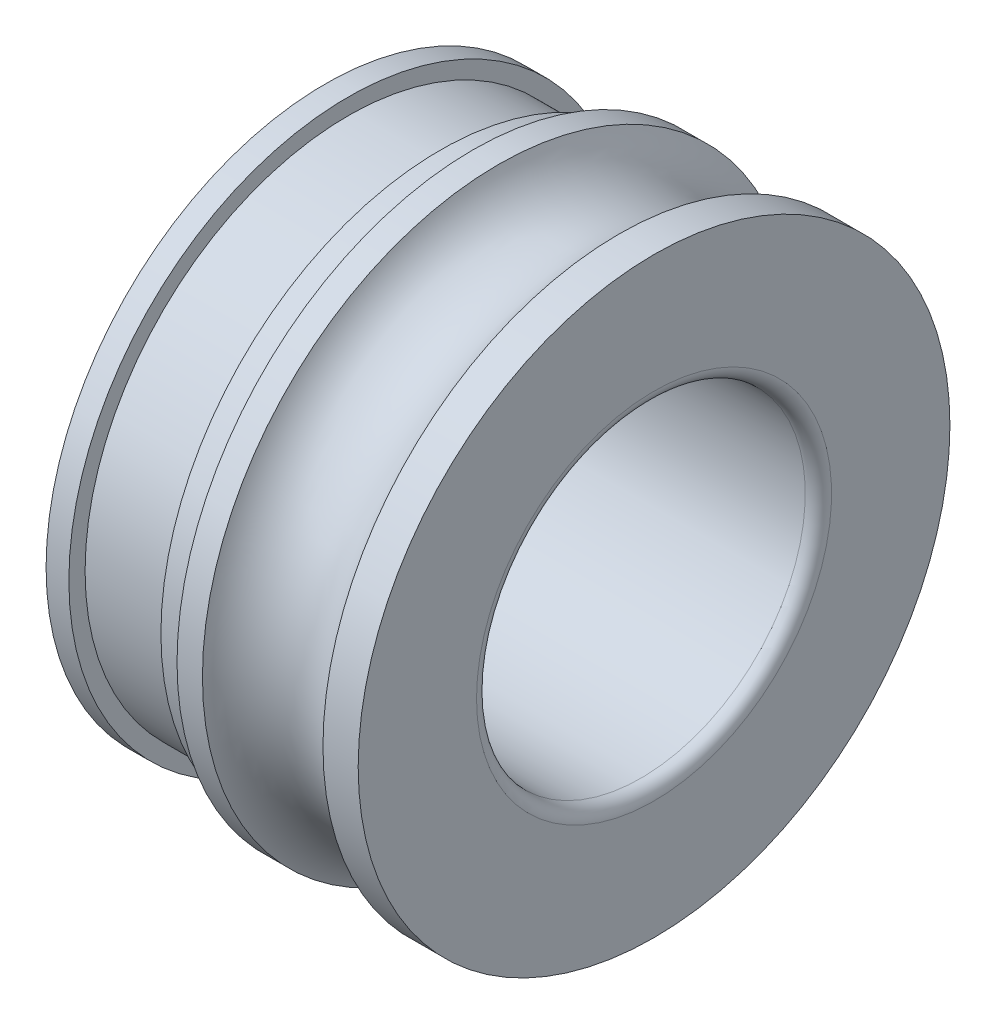
from build123d import *


with BuildPart() as part:
    # Esquisse1 → Base-Révolution (revolve)
    with BuildSketch(Plane.XY, mode=Mode.PRIVATE) as base_r_volution_sk:
        with BuildLine():
            Line((1, 12.5), (24, 12.5))
            ThreePointArc((24, 12.5), (24.707106781, 12.792893219), (25, 13.5))
            Line((25, 13.5), (25, 22.5))
            Line((25, 22.5), (22.321383042, 22.499995211))
            ThreePointArc((22.321383042, 22.499995211), (17.738807347, 19.499995211), (13.156231652, 22.499995211))
            Line((13.156231652, 22.499995211), (11.22402651, 22.499995211))
            Line((11.22402651, 22.499995211), (11.232186751, 21.25))
            Line((11.232186751, 21.25), (8.732186751, 21.233679457))
            Line((8.732186751, 21.233679457), (8.732186751, 20))
            Line((8.732186751, 20), (1.732186751, 20))
            Line((1.732186751, 20), (1.732186751, 21.233679457))
            Line((1.732186751, 21.233679457), (0, 21.233679457))
            Line((0, 21.233679457), (0, 20))
            Line((0, 20), (0, 13.5))
            ThreePointArc((0, 13.5), (0.292893219, 12.792893219), (1, 12.5))
        make_face()
    revolve(base_r_volution_sk.sketch.rotate(Axis((0, 0, 0), (1, 0, 0)), 90), axis=Axis((0, 0, 0), (1, 0, 0)))


solid = part.part
